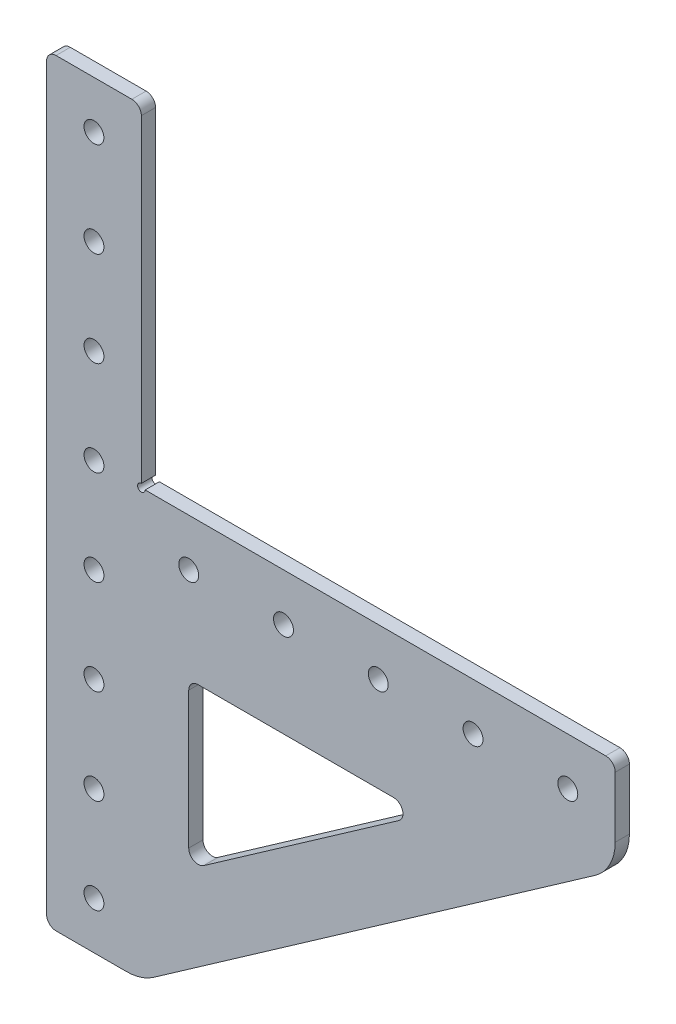
from build123d import *

# Parameters (mm, degrees)
SKETCH1_R           = 2.1
BOSS_EXTRUDE1_DEPTH = 3
FILLET1_R           = 2
SKETCH3_R           = 0.8
CUT_EXTRUDE1_DEPTH  = 145.25324953
BOSS_EXTRUDE2_START = -3
BOSS_EXTRUDE2_DEPTH = 3
CUT_EXTRUDE2_DEPTH  = 145.25324953
FILLET2_R           = 2
FILLET3_R           = 10


with BuildPart() as part:
    # Sketch1 → Boss-Extrude1 (new body)
    with BuildSketch(Plane.XY):
        Polygon((-100, -80), (-100, -10), (0, -10), (0, 10), (-100, 10), (-100, 80), (-120, 80), (-120, -80), align=None)
        with Locations((-110, 70)):
            Circle(SKETCH1_R, mode=Mode.SUBTRACT)
        with Locations((-110, 50)):
            Circle(SKETCH1_R, mode=Mode.SUBTRACT)
        with Locations((-110, 30)):
            Circle(SKETCH1_R, mode=Mode.SUBTRACT)
        with Locations((-110, 10)):
            Circle(SKETCH1_R, mode=Mode.SUBTRACT)
        with Locations((-110, -10)):
            Circle(SKETCH1_R, mode=Mode.SUBTRACT)
        with Locations((-110, -30)):
            Circle(SKETCH1_R, mode=Mode.SUBTRACT)
        with Locations((-110, -50)):
            Circle(SKETCH1_R, mode=Mode.SUBTRACT)
        with Locations((-110, -70)):
            Circle(SKETCH1_R, mode=Mode.SUBTRACT)
        with Locations((-10, 0)):
            Circle(SKETCH1_R, mode=Mode.SUBTRACT)
        with Locations((-30, 0)):
            Circle(SKETCH1_R, mode=Mode.SUBTRACT)
        with Locations((-50, 0)):
            Circle(SKETCH1_R, mode=Mode.SUBTRACT)
        with Locations((-70, 0)):
            Circle(SKETCH1_R, mode=Mode.SUBTRACT)
        with Locations((-90, 0)):
            Circle(SKETCH1_R, mode=Mode.SUBTRACT)
    extrude(amount=BOSS_EXTRUDE1_DEPTH)

    # Fillet1
    fillet1_edges = [part.edges().sort_by_distance(p)[0] for p in [
        (-120, -80, 1.5),
        (-120, 80, 1.5),
        (-100, 80, 1.5),
        (0, 10, 1.5),
        (0, -10, 1.5),
        (-100, -80, 1.5),
    ]]
    fillet(fillet1_edges, radius=FILLET1_R)

    # Sketch3 → Cut-Extrude1 (cut, through all)
    with BuildSketch(Plane.XY.offset(3)):
        with Locations((-100, 10)):
            Circle(SKETCH3_R)
        with Locations((-100, -10)):
            Circle(SKETCH3_R)
    extrude(amount=-CUT_EXTRUDE1_DEPTH, mode=Mode.SUBTRACT)

    # Sketch4 → Boss-Extrude2 (add)
    with BuildSketch(Plane(origin=(0, 0, 0), x_dir=(-1, 0, 0), z_dir=(0, 0, -1)).offset(BOSS_EXTRUDE2_START)):
        with BuildLine():
            Line((0, -8), (0, -10))
            Line((0, -10), (100, -80))
            Line((100, -80), (102, -80))
            ThreePointArc((102, -80), (100.585786438, -79.414213562), (100, -78))
            Line((100, -78), (100, -10.8))
            ThreePointArc((100, -10.8), (100.565685425, -9.434314575), (99.2, -10))
            Line((99.2, -10), (2, -10))
            ThreePointArc((2, -10), (0.585786438, -9.414213562), (0, -8))
        make_face()
    extrude(amount=BOSS_EXTRUDE2_DEPTH)

    # Sketch5 → Cut-Extrude2 (cut, through all)
    with BuildSketch(Plane(origin=(0, 0, 0), x_dir=(-1, 0, 0), z_dir=(0, 0, -1))):
        Polygon((40.442619177, -20), (90, -20), (90, -54.690166576), align=None)
    extrude(amount=-CUT_EXTRUDE2_DEPTH, mode=Mode.SUBTRACT)

    # Fillet2
    fillet2_edges = [part.edges().sort_by_distance(p)[0] for p in [
        (-90, -54.690166576, 1.5),
        (-40.442619177, -20, 1.5),
        (-90, -20, 1.5),
    ]]
    fillet(fillet2_edges, radius=FILLET2_R)

    # Fillet3
    fillet3_edges = [part.edges().sort_by_distance(p)[0] for p in [
        (-100, -80, 1.5),
        (0, -10, 1.5),
    ]]
    fillet(fillet3_edges, radius=FILLET3_R)


solid = part.part
